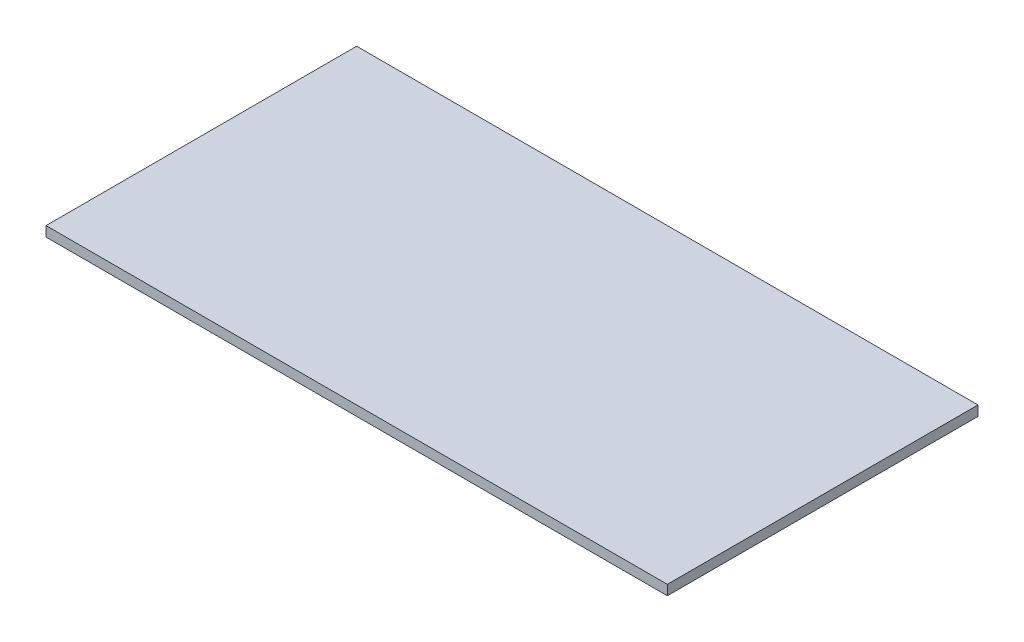
from build123d import *

# Parameters (mm, degrees)
SKETCH_1_W      = 100
SKETCH_1_H      = 50
EXTRUDE_1_DEPTH = 1.6


with BuildPart() as part:
    # Эскиз1 → Бобышка-Вытянуть1 (new body)
    with BuildSketch(Plane(origin=(0, 0, 0), x_dir=(1, 0, 0), z_dir=(0, 1, 0))):
        Rectangle(SKETCH_1_W, SKETCH_1_H)
    extrude(amount=EXTRUDE_1_DEPTH)


solid = part.part
